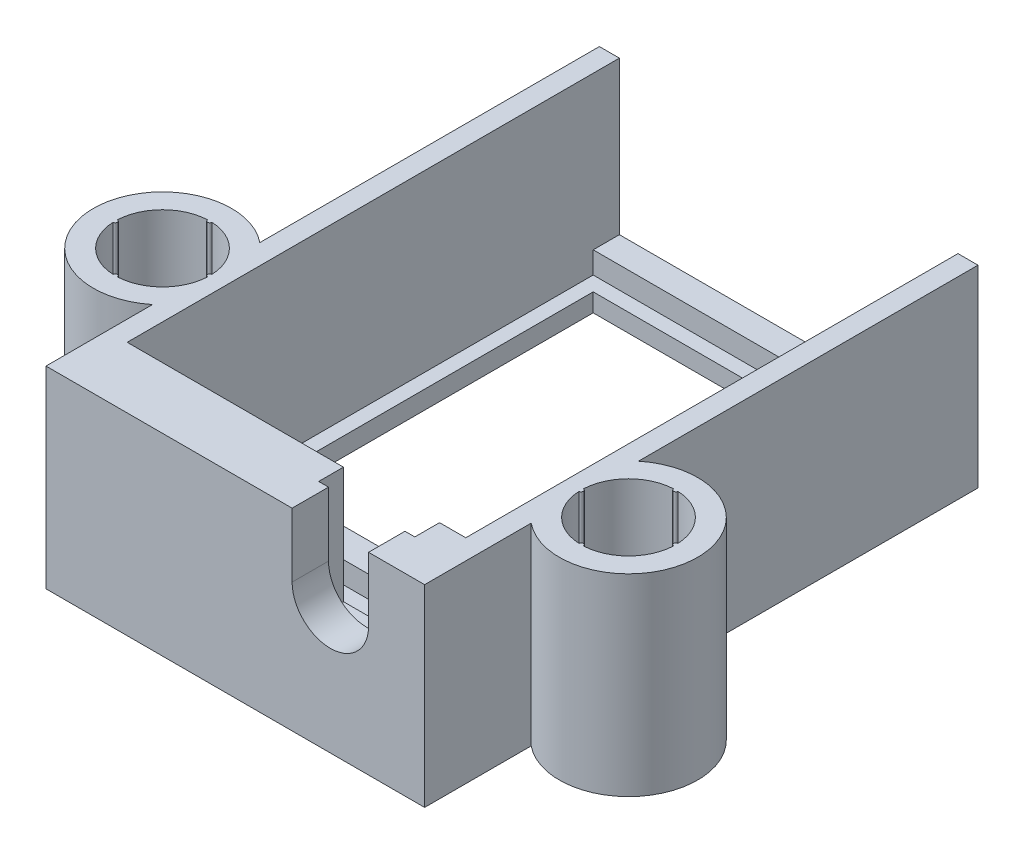
from build123d import *

# Parameters (mm, degrees)
SKETCH1_R           = 3.25
BOSS_EXTRUDE1_DEPTH = 13.25
SKETCH2_W           = 23.25
SKETCH2_H           = 33.8
CUT_EXTRUDE1_DEPTH  = 12
CUT_EXTRUDE2_REACH  = 46.442
SKETCH3_R           = 2.625
SKETCH4_W           = 6.6
SKETCH4_H           = 1.7
CUT_EXTRUDE3_DEPTH  = 8
SKETCH5_W           = 23.25
SKETCH5_H           = 2
SKETCH5_H_2         = 1.8
BOSS_EXTRUDE2_DEPTH = 1.5
CUT_EXTRUDE4_REACH  = 38.105
SKETCH6_W           = 21.25
SKETCH6_H           = 23
SKETCH7_R           = 0.15
BOSS_EXTRUDE3_DEPTH = 13.25
BOSS_EXTRUDE4_START = 1
BOSS_EXTRUDE4_DEPTH = 1


with BuildPart() as part:
    # Sketch1 → Boss-Extrude1 (new body)
    with BuildSketch(Plane(origin=(0, 0, 0), x_dir=(1, 0, 0), z_dir=(0, 1, 0))):
        with BuildLine():
            Line((13, 27), (-13, 27))
            Line((-13, 27), (-13, 3.682729966))
            ThreePointArc((-13, 3.682729966), (-20.75, 0), (-13, -3.682729966))
            Line((-13, -3.682729966), (-13, -10))
            Line((-13, -10), (13, -10))
            Line((13, -10), (13, -3.682729966))
            ThreePointArc((13, -3.682729966), (20.75, 0), (13, 3.682729966))
            Line((13, 3.682729966), (13, 27))
        make_face()
        with Locations(Location((-16, 0, 0), (0, 0, 270))):
            Circle(SKETCH1_R, mode=Mode.SUBTRACT)
        with Locations(Location((16, 0, 0), (0, 0, 270))):
            Circle(SKETCH1_R, mode=Mode.SUBTRACT)
    extrude(amount=BOSS_EXTRUDE1_DEPTH)

    # Sketch2 → Cut-Extrude1 (cut)
    with BuildSketch(Plane(origin=(0, 13.25, 0), x_dir=(1, 0, 0), z_dir=(0, 1, 0))):
        with Locations((0, 10.1)):
            Rectangle(SKETCH2_W, SKETCH2_H)
    extrude(amount=-CUT_EXTRUDE1_DEPTH, mode=Mode.SUBTRACT)

    # Sketch3 → Cut-Extrude2 (cut, up to next)
    with BuildSketch(Plane.XY.offset(10), mode=Mode.PRIVATE) as cut_extrude2_sk1:
        with BuildLine():
            Line((3.9, 13.25), (3.9, 8.85))
            ThreePointArc((3.9, 8.85), (6.525, 11.475), (9.15, 8.85))
            Line((9.15, 8.85), (9.15, 13.25))
            Line((9.15, 13.25), (3.9, 13.25))
        make_face()
    cut_extrude2_tool1 = extrude(cut_extrude2_sk1.sketch, amount=-CUT_EXTRUDE2_REACH, mode=Mode.PRIVATE) & part.part
    # Sketch3 → Cut-Extrude2 (cut, up to next)
    with BuildSketch(Plane.XY.offset(10), mode=Mode.PRIVATE) as cut_extrude2_sk2:
        with Locations((6.525, 8.85)):
            Circle(SKETCH3_R)
    cut_extrude2_tool2 = extrude(cut_extrude2_sk2.sketch, amount=-CUT_EXTRUDE2_REACH, mode=Mode.PRIVATE) & part.part
    add(cut_extrude2_tool1.solids().sort_by_distance((6.525, 12.007435, 10))[0], mode=Mode.SUBTRACT)
    add(cut_extrude2_tool2.solids().sort_by_distance((6.525, 8.85, 10))[0], mode=Mode.SUBTRACT)

    # Sketch4 → Cut-Extrude3 (cut)
    with BuildSketch(Plane(origin=(0, 13.25, 0), x_dir=(1, 0, 0), z_dir=(0, 1, 0))):
        with Locations((6.525, -7.65)):
            Rectangle(SKETCH4_W, SKETCH4_H)
    extrude(amount=-CUT_EXTRUDE3_DEPTH, mode=Mode.SUBTRACT)

    # Sketch5 → Boss-Extrude2 (add)
    with BuildSketch(Plane(origin=(0, 1.25, 0), x_dir=(1, 0, 0), z_dir=(0, 1, 0))):
        with Locations((0, -0.8)):
            Rectangle(SKETCH5_W, SKETCH5_H)
        with Locations((0, 26.1)):
            Rectangle(SKETCH5_W, SKETCH5_H_2)
    extrude(amount=BOSS_EXTRUDE2_DEPTH)

    # Sketch6 → Cut-Extrude4 (cut, up to next)
    with BuildSketch(Plane(origin=(0, 1.25, 0), x_dir=(1, 0, 0), z_dir=(0, 1, 0)), mode=Mode.PRIVATE) as cut_extrude4_sk1:
        with Locations((0, 12.7)):
            Rectangle(SKETCH6_W, SKETCH6_H)
    cut_extrude4_tool1 = extrude(cut_extrude4_sk1.sketch, amount=-CUT_EXTRUDE4_REACH, mode=Mode.PRIVATE) & part.part
    add(cut_extrude4_tool1.solids().sort_by_distance((0, 1.25, -12.7))[0], mode=Mode.SUBTRACT)

    # Sketch7 → Boss-Extrude3 (add)
    with BuildSketch(Plane(origin=(0, 13.25, 0), x_dir=(1, 0, 0), z_dir=(0, 1, 0))):
        with Locations((-16, 3.25)):
            Circle(SKETCH7_R)
        with Locations((-19.25, 0)):
            Circle(SKETCH7_R)
        with Locations((-12.75, 0)):
            Circle(SKETCH7_R)
        with Locations((-16, -3.25)):
            Circle(SKETCH7_R)
        with Locations((16, -3.25)):
            Circle(SKETCH7_R)
        with Locations((12.75, 0)):
            Circle(SKETCH7_R)
        with Locations((19.25, 0)):
            Circle(SKETCH7_R)
        with Locations((16, 3.25)):
            Circle(SKETCH7_R)
    extrude(amount=-BOSS_EXTRUDE3_DEPTH)

    # Sketch8 → Boss-Extrude4 (add)
    with BuildSketch(Plane.XY.offset(10).offset(BOSS_EXTRUDE4_START)):
        with BuildLine():
            Line((3.9, 8.85), (3.9, 13.25))
            Line((3.9, 13.25), (-13, 13.25))
            Line((-13, 13.25), (-13, 0))
            Line((-13, 0), (13, 0))
            Line((13, 0), (13, 13.25))
            Line((13, 13.25), (9.15, 13.25))
            Line((9.15, 13.25), (9.15, 8.85))
            ThreePointArc((9.15, 8.85), (6.525, 6.225), (3.9, 8.85))
        make_face()
    extrude(amount=-BOSS_EXTRUDE4_DEPTH)


solid = part.part
